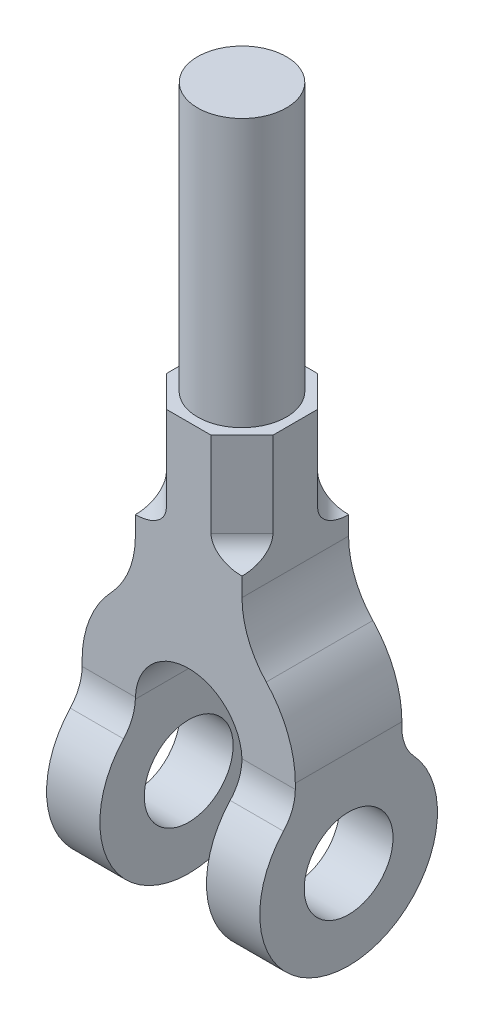
from build123d import *

# Parameters (mm, degrees)
SKETCH1_W           = 120
SKETCH1_H           = 250
BOSS_EXTRUDE1_DEPTH = 100
CUT_EXTRUDE1_DEPTH  = 295.78805946
SKETCH3_R           = 25
CUT_EXTRUDE2_DEPTH  = 295.78805946
CUT_EXTRUDE3_DEPTH  = 60
SKETCH4_3_R         = 25
BOSS_EXTRUDE2_DEPTH = 150.7
FILLET2_R           = 12


with BuildPart() as part:
    # Sketch1 → Boss-Extrude1 (new body)
    with BuildSketch(Plane.XY):
        with Locations((-60, 125)):
            Rectangle(SKETCH1_W, SKETCH1_H)
    extrude(amount=BOSS_EXTRUDE1_DEPTH)

    # Sketch2 → Cut-Extrude1 (cut, through all)
    with BuildSketch(Plane.XY.offset(100)):
        with BuildLine():
            Line((-90, 179.498344353), (-90, 250))
            Line((-90, 250), (-120, 250))
            Line((-120, 250), (-120, 104))
            ThreePointArc((-120, 104), (-115.759222637, 126.156468376), (-103.636363636, 145.180915101))
            ThreePointArc((-103.636363636, 145.180915101), (-93.533981136, 161.034620706), (-90, 179.498344353))
        make_face()
        with BuildLine():
            Line((0, 250), (-30, 250))
            Line((-30, 250), (-30, 179.498344353))
            ThreePointArc((-30, 179.498344353), (-26.466018864, 161.034620706), (-16.363636364, 145.180915101))
            ThreePointArc((-16.363636364, 145.180915101), (-4.240777331, 126.156468297), (0, 103.999999829))
            Line((0, 103.999999829), (0, 250))
        make_face()
        with BuildLine():
            Line((-30, 0), (-30, 100))
            ThreePointArc((-30, 100), (-60, 130), (-90, 100))
            Line((-90, 100), (-90, 0))
            Line((-90, 0), (-30, 0))
        make_face()
    extrude(amount=-CUT_EXTRUDE1_DEPTH, mode=Mode.SUBTRACT)

    # Sketch3 → Cut-Extrude2 (cut, through all)
    with BuildSketch(Plane(origin=(0, 0, 0), x_dir=(0, 0, -1), z_dir=(1, 0, 0))):
        with BuildLine():
            ThreePointArc((-86.666666667, 83.993463424), (-81.726266594, 91.861485844), (-80, 100.990195136))
            Line((-80, 100.990195136), (-80, 250))
            Line((-80, 250), (-100, 250))
            Line((-100, 250), (-100, 50))
            ThreePointArc((-100, 50), (-96.547466813, 68.257418584), (-86.666666667, 83.993463424))
        make_face()
        with BuildLine():
            Line((0, 50.000000014), (0, 250))
            Line((0, 250), (-20, 250))
            Line((-20, 250), (-20, 100.990195136))
            ThreePointArc((-20, 100.990195136), (-18.273733406, 91.861485844), (-13.333333333, 83.993463424))
            ThreePointArc((-13.333333333, 83.993463424), (-3.45253319, 68.25741859), (0, 50.000000014))
        make_face()
        with BuildLine():
            ThreePointArc((-50, 0), (-85.355339059, 14.644660941), (-100, 50))
            Line((-100, 50), (-100, 0))
            Line((-100, 0), (-50, 0))
        make_face()
        with BuildLine():
            ThreePointArc((0, 50.000000014), (-14.644660936, 14.644660946), (-50, 0))
            Line((-50, 0), (0, 0))
            Line((0, 0), (0, 50.000000014))
        make_face()
        with Locations((-50, 50)):
            Circle(SKETCH3_R)
    extrude(amount=-CUT_EXTRUDE2_DEPTH, mode=Mode.SUBTRACT)

    # Sketch4 → Cut-Extrude3 (cut)
    with BuildSketch(Plane(origin=(0, 250, 0), x_dir=(1, 0, 0), z_dir=(0, 1, 0))):
        Polygon((-90, -62.6), (-90, -80), (-72.6, -80), align=None)
        Polygon((-30, -62.6), (-47.4, -80), (-30, -80), align=None)
        Polygon((-90, -20), (-90, -37.4), (-72.6, -20), align=None)
        Polygon((-47.4, -20), (-30, -37.4), (-30, -20), align=None)
    extrude(amount=-CUT_EXTRUDE3_DEPTH, mode=Mode.SUBTRACT)

    # Sketch4<3> → Boss-Extrude2 (add)
    with BuildSketch(Plane(origin=(0, 250, 0), x_dir=(1, 0, 0), z_dir=(0, 1, 0))):
        with Locations((-60, -50)):
            Circle(SKETCH4_3_R)
    extrude(amount=BOSS_EXTRUDE2_DEPTH)

    # Fillet2
    fillet2_edges = [part.edges().sort_by_distance(p)[0] for p in [
        (-81.3, 190, 71.3),
        (-38.7, 190, 71.3),
        (-38.7, 190, 28.7),
        (-81.3, 190, 28.7),
    ]]
    fillet(fillet2_edges, radius=FILLET2_R)


solid = part.part
